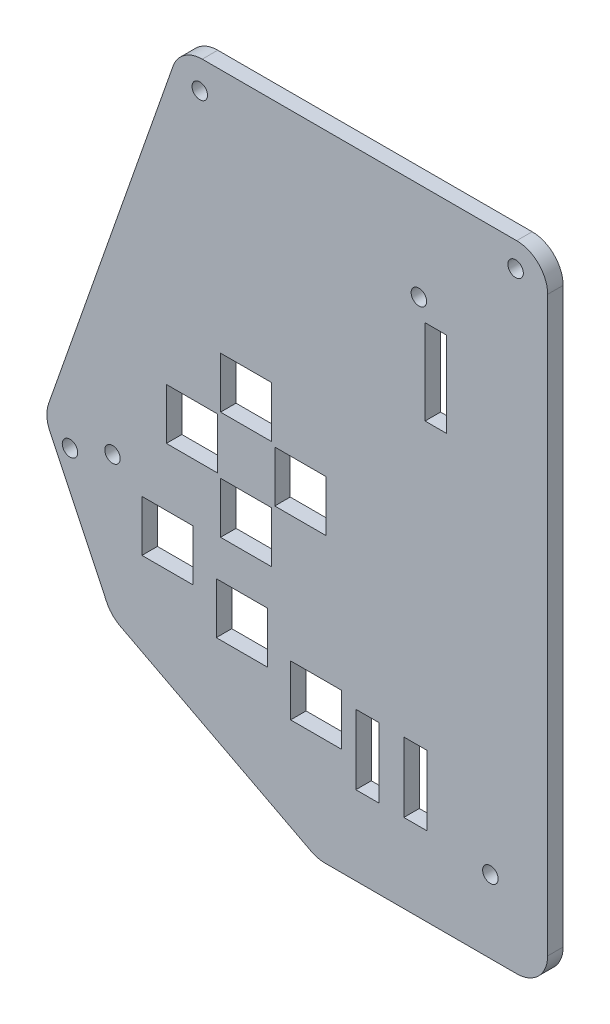
from build123d import *

# Parameters (mm, degrees)
BOSS_EXTRUDE1_DEPTH     = 2.54
CUT_EXTRUDE1_DEPTH      = 112.420336115
CUT_EXTRUDE1_DEPTH_BACK = 112.420336115
SKETCH11_W              = 3.81
SKETCH11_H              = 11.43
SKETCH11_W_2            = 8.382
SKETCH11_H_2            = 8.382
CUT_EXTRUDE2_DEPTH      = 112.420336115
CUT_EXTRUDE2_DEPTH_BACK = 112.420336115
SKETCH12_R              = 1.27
CUT_EXTRUDE3_DEPTH      = 112.420336115
CUT_EXTRUDE3_DEPTH_BACK = 112.420336115
SKETCH13_R              = 1.27
CUT_EXTRUDE4_DEPTH      = 112.420336115
CUT_EXTRUDE4_DEPTH_BACK = 112.420336115
SKETCH14_W              = 3.556
SKETCH14_H              = 13.97
CUT_EXTRUDE5_DEPTH      = 112.420336115
CUT_EXTRUDE5_DEPTH_BACK = 112.420336115
SKETCH16_R              = 1.27


with BuildPart() as part:
    # Sketch10 → Boss-Extrude1 (new body)
    with BuildSketch(Plane.XY):
        with BuildLine():
            Line((53.34, 1.27), (53.34, -92.71))
            ThreePointArc((53.34, -92.71), (51.852102448, -96.302102448), (48.26, -97.79))
            Line((48.26, -97.79), (16.846989059, -97.79))
            ThreePointArc((16.846989059, -97.79), (15.638688158, -97.644208035), (14.499741809, -97.215200367))
            Line((14.499741809, -97.215200367), (-16.7505185, -80.933552139))
            ThreePointArc((-16.7505185, -80.933552139), (-18.059258376, -79.955412607), (-18.989802686, -78.61241436))
            Line((-18.989802686, -78.61241436), (-28.309569459, -59.040904135))
            ThreePointArc((-28.309569459, -59.040904135), (-28.795802898, -57.127870198), (-28.51617555, -55.173917704))
            Line((-28.51617555, -55.173917704), (-8.107195629, 2.952923842))
            ThreePointArc((-8.107195629, 2.952923842), (-6.251501454, 5.414614163), (-3.314058103, 6.35))
            Line((-3.314058103, 6.35), (48.26, 6.35))
            ThreePointArc((48.26, 6.35), (51.852102448, 4.862102448), (53.34, 1.27))
        make_face()
    extrude(amount=BOSS_EXTRUDE1_DEPTH)

    # Sketch11 → Cut-Extrude1 (cut, two sides: drawn at the far end of the back side and taken through both)
    with BuildSketch(Plane.XY.offset(2.54).offset(-CUT_EXTRUDE1_DEPTH_BACK)):
        with Locations((31.65602, -79.121)):
            Rectangle(SKETCH11_W, SKETCH11_H)
        with Locations((23.78202, -79.121)):
            Rectangle(SKETCH11_W, SKETCH11_H)
        with Locations((3.878385852, -55.88)):
            Rectangle(SKETCH11_W_2, SKETCH11_H_2)
        with Locations((-5.011614148, -46.99)):
            Rectangle(SKETCH11_W_2, SKETCH11_H_2)
        with Locations((3.878385852, -38.1)):
            Rectangle(SKETCH11_W_2, SKETCH11_H_2)
        with Locations((12.768385852, -46.99)):
            Rectangle(SKETCH11_W_2, SKETCH11_H_2)
        with Locations((-9.017, -64.897)):
            Rectangle(SKETCH11_W_2, SKETCH11_H_2)
        with Locations((3.175, -70.485)):
            Rectangle(SKETCH11_W_2, SKETCH11_H_2)
        with Locations((15.367, -76.073)):
            Rectangle(SKETCH11_W_2, SKETCH11_H_2)
    extrude(amount=CUT_EXTRUDE1_DEPTH + CUT_EXTRUDE1_DEPTH_BACK, mode=Mode.SUBTRACT)

    # Sketch12 → Cut-Extrude2 (cut, two sides: drawn at the far end of the back side and taken through both)
    with BuildSketch(Plane(origin=(0, 0, 0), x_dir=(-1, 0, 0), z_dir=(0, 0, -1)).offset(-CUT_EXTRUDE2_DEPTH_BACK)):
        with Locations((18.034, -57.15)):
            Circle(SKETCH12_R)
        with Locations((-43.942, -85.852)):
            Circle(SKETCH12_R)
    extrude(amount=CUT_EXTRUDE2_DEPTH + CUT_EXTRUDE2_DEPTH_BACK, mode=Mode.SUBTRACT)

    # Sketch13 → Cut-Extrude3 (cut, two sides: drawn at the far end of the back side and taken through both)
    with BuildSketch(Plane(origin=(0, 0, 0), x_dir=(-1, 0, 0), z_dir=(0, 0, -1)).offset(-CUT_EXTRUDE3_DEPTH_BACK)):
        with Locations((25.012261453, -59.761967182)):
            Circle(SKETCH13_R)
        with Locations((-48.0822, 2.286)):
            Circle(SKETCH13_R)
        with Locations((3.718687848, 1.651)):
            Circle(SKETCH13_R)
    extrude(amount=CUT_EXTRUDE3_DEPTH + CUT_EXTRUDE3_DEPTH_BACK, mode=Mode.SUBTRACT)

    # Sketch14 → Cut-Extrude4 (cut, two sides: drawn at the far end of the back side and taken through both)
    with BuildSketch(Plane(origin=(0, 0, 0), x_dir=(-1, 0, 0), z_dir=(0, 0, -1)).offset(-CUT_EXTRUDE4_DEPTH_BACK)):
        with Locations((-35.010498686, -19.798068862)):
            Rectangle(SKETCH14_W, SKETCH14_H)
    extrude(amount=CUT_EXTRUDE4_DEPTH + CUT_EXTRUDE4_DEPTH_BACK, mode=Mode.SUBTRACT)

    # Sketch16 → Cut-Extrude5 (cut, two sides: drawn at the far end of the back side and taken through both)
    with BuildSketch(Plane(origin=(0, 0, 0), x_dir=(-1, 0, 0), z_dir=(0, 0, -1)).offset(-CUT_EXTRUDE5_DEPTH_BACK)):
        with Locations((-32.21898687, -9.676053038)):
            Circle(SKETCH16_R)
    extrude(amount=CUT_EXTRUDE5_DEPTH + CUT_EXTRUDE5_DEPTH_BACK, mode=Mode.SUBTRACT)


solid = part.part
